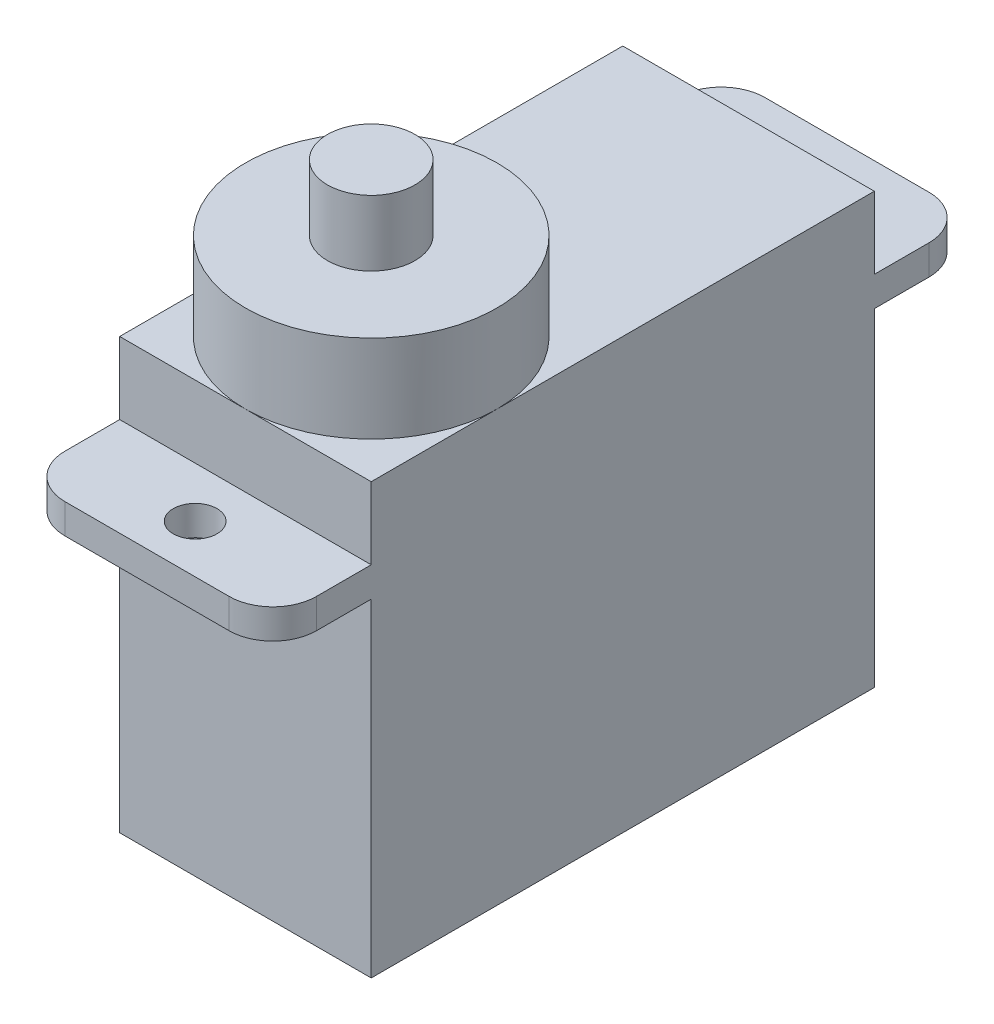
from build123d import *

# Parameters (mm, degrees)
SKETCH_1_W          = 11.5
SKETCH_1_H          = 23
EXTRUDE_1_DEPTH     = 19.65
SKETCH_3_W          = 11.5
SKETCH_3_H          = 32
EXTRUDE_3_DEPTH     = 1.36
SKETCH_4_R          = 1
CUT_EXTRUDE_1_DEPTH = 5
FILLET_8_R          = 2
SKETCH_9_R          = 5.75
EXTRUDE_7_DEPTH     = 4
SKETCH_10_R         = 2
EXTRUDE_8_DEPTH     = 3


with BuildPart() as part:
    # 草图1 → 凸台-拉伸1 (new body)
    with BuildSketch(Plane(origin=(0, 0, 0), x_dir=(1, 0, 0), z_dir=(0, 1, 0))):
        Rectangle(SKETCH_1_W, SKETCH_1_H)
    extrude(amount=EXTRUDE_1_DEPTH)

    # 草图3 → 凸台-拉伸3 (add)
    with BuildSketch(Plane(origin=(0, 15, 0), x_dir=(-1, 0, 0), z_dir=(0, -1, 0))):
        Rectangle(SKETCH_3_W, SKETCH_3_H)
    extrude(amount=-EXTRUDE_3_DEPTH)

    # 草图4 → 切除-拉伸1 (cut)
    with BuildSketch(Plane(origin=(0, 15, 0), x_dir=(-1, 0, 0), z_dir=(0, -1, 0))):
        with Locations(Location((0, 13.8, 0), (0, 0, 90))):
            Circle(SKETCH_4_R)
        with Locations(Location((0, -13.8, 0), (0, 0, 90))):
            Circle(SKETCH_4_R)
    extrude(amount=-CUT_EXTRUDE_1_DEPTH, mode=Mode.SUBTRACT)

    # 圆角8
    fillet_8_edges = [part.edges().sort_by_distance(p)[0] for p in [
        (-5.75, 15.68, -16),
        (5.75, 15.68, 16),
        (-5.75, 15.68, 16),
        (5.75, 15.68, -16),
    ]]
    fillet(fillet_8_edges, radius=FILLET_8_R)

    # 草图9 → 凸台-拉伸7 (add)
    with BuildSketch(Plane(origin=(0, 19.65, 0), x_dir=(1, 0, 0), z_dir=(0, 1, 0))):
        with Locations(Location((0, -5.75, 0), (0, 0, 270))):
            Circle(SKETCH_9_R)
    extrude(amount=EXTRUDE_7_DEPTH)

    # 草图10 → 凸台-拉伸8 (add)
    with BuildSketch(Plane(origin=(0, 23.65, 0), x_dir=(1, 0, 0), z_dir=(0, 1, 0))):
        with Locations(Location((0, -5.75, 0), (0, 0, 270))):
            Circle(SKETCH_10_R)
    extrude(amount=EXTRUDE_8_DEPTH)


solid = part.part
